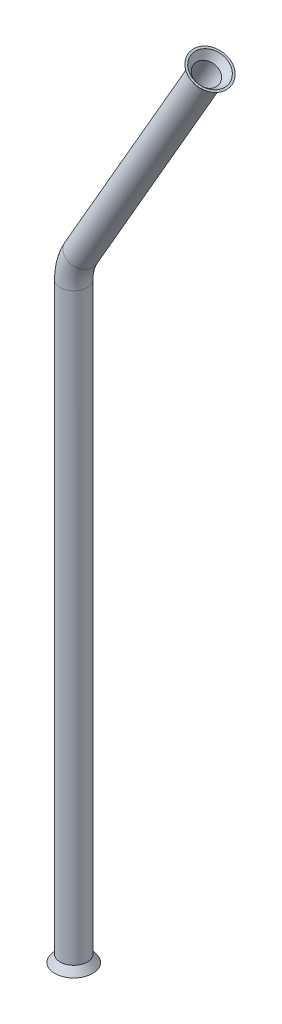
from build123d import *

# Parameters (mm, degrees)
SKETCH1_R           = 4.826
SKETCH1_R_2         = 4.064
SKETCH3_R           = 4.826
BOSS_EXTRUDE1_DEPTH = 2.54
BOSS_EXTRUDE1_DRAFT = -37
SKETCH5_R           = 4.826
BOSS_EXTRUDE2_DEPTH = 2.54
BOSS_EXTRUDE2_DRAFT = -37


with BuildPart() as part:
    # Sweep1: sweep along a path in Sketch2
    with BuildLine(Plane.XY) as sweep1_path:
        Line((0, 0), (0, 206.956941604))
        ThreePointArc((0, 206.956941604), (0.649113009, 211.887444413), (2.552216058, 216.481941604))
        Line((2.552216058, 216.481941604), (47.002216058, 293.4716))
    # Sketch1 → Sweep1 (sweep)
    with BuildSketch(Plane(origin=(0, 0, 0), x_dir=(1, 0, 0), z_dir=(0, 1, 0))):
        Circle(SKETCH1_R)
        Circle(SKETCH1_R_2, mode=Mode.SUBTRACT)
    sweep(path=sweep1_path.line)


with BuildPart() as boss_extrude1_tool:
    # Sketch3 → Boss-Extrude1 (with draft: the straight prism first)
    with BuildSketch(Plane.XZ):
        with Locations(Location((0, 0, 0), (0, 0, 180))):
            Circle(SKETCH3_R)
    extrude(amount=BOSS_EXTRUDE1_DEPTH)
    # Boss-Extrude1: the draft: its side faces are tilted about the plane it starts from
    boss_extrude1_sides = [boss_extrude1_tool.faces().sort_by_distance(p)[0] for p in [
        (4.826, -1.27, 0),
    ]]
    draft(boss_extrude1_sides, Plane.XZ, BOSS_EXTRUDE1_DRAFT)


with BuildPart() as part_1:
    add(part.part)

    # Boss-Extrude1: add boss_extrude1_tool
    add(boss_extrude1_tool.part)

    # Cut-Extrude1 cone 1 section (through the dimple's axis) → Cut-Extrude1 (revolve, cut)
    with BuildSketch(Plane(origin=(0, -2.54, 0), x_dir=(0, 0, -1), z_dir=(1, 0, 0))):
        Polygon((0, 0), (5.978027287, 0), (0, 7.933110155), align=None)
    revolve(axis=Axis((0, -2.54, 0), (0, 1, 0)), mode=Mode.SUBTRACT)


with BuildPart() as boss_extrude2_tool:
    # Sketch5 → Boss-Extrude2 (with draft: the straight prism first)
    with BuildSketch(Plane(origin=(138.827484459, 240.45625657, 0), x_dir=(0, 0, -1), z_dir=(0.5000000000000008, 0.8660254037844382, 0))):
        with Locations(Location((0, 106.03068686, 0), (0, 0, 90))):
            Circle(SKETCH5_R)
    extrude(amount=BOSS_EXTRUDE2_DEPTH)
    # Boss-Extrude2: the draft: its side faces are tilted about the plane it starts from
    boss_extrude2_sides = [boss_extrude2_tool.faces().sort_by_distance(p)[0] for p in [
        (51.816654657, 292.158452263, 0),
    ]]
    draft(boss_extrude2_sides, Plane(origin=(138.827484459, 240.45625657, 0), x_dir=(0, 0, -1), z_dir=(0.5000000000000008, 0.8660254037844382, 0)), BOSS_EXTRUDE2_DRAFT)


with BuildPart() as part_2:
    add(part_1.part)

    # Boss-Extrude2: add boss_extrude2_tool
    add(boss_extrude2_tool.part)

    # Cut-Extrude2 cone 1 section (through the dimple's axis) → Cut-Extrude2 (revolve, cut)
    with BuildSketch(Plane(origin=(48.272216058, 295.671304526, 0), x_dir=(0, 0, 1), z_dir=(0.866025404, -0.5, 0))):
        Polygon((0, 0), (5.978027287, 0), (0, 7.933110155), align=None)
    revolve(axis=Axis((48.272216058, 295.671304526, 0), (-0.5, -0.866025404, 0)), mode=Mode.SUBTRACT)


solid = part_2.part
